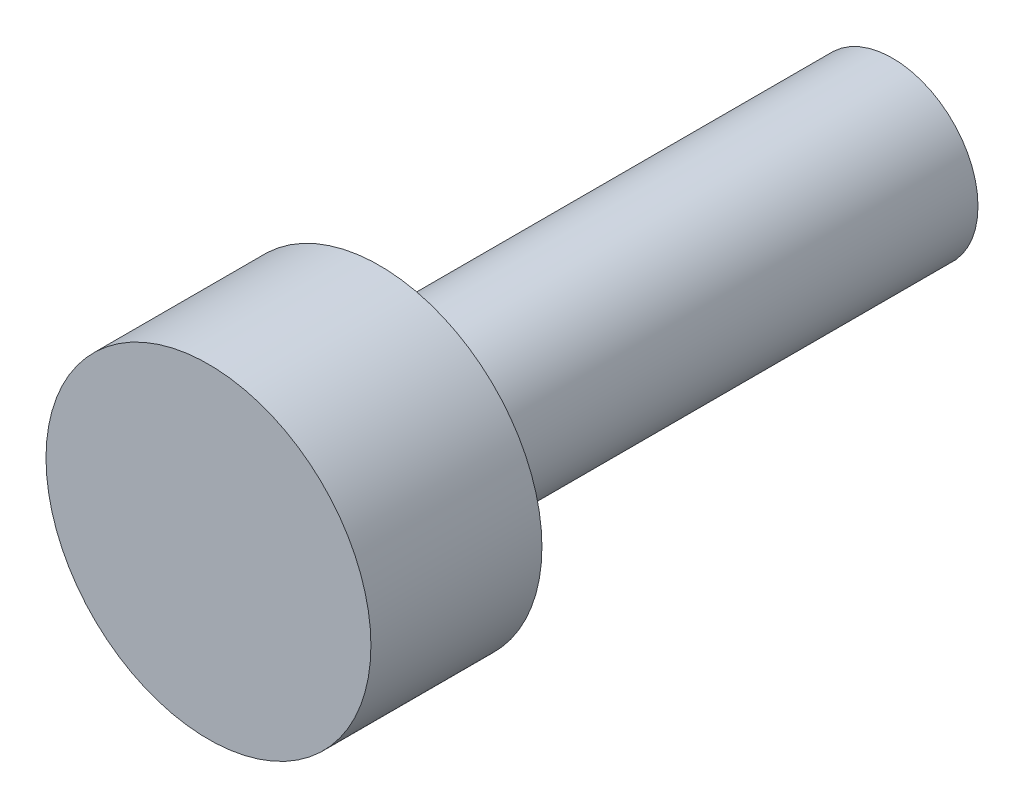
from build123d import *

# Parameters (mm, degrees)
THREAD_ENVELOPE_START = -6
SKETCH1_R             = 1
THREAD_ENVELOPE_DEPTH = 6
SKETCH2_R             = 1.9
HEAD_ENVELOPE_DEPTH   = 2


with BuildPart() as part:
    # Sketch1 → Thread_Envelope (new body)
    with BuildSketch(Plane.XY.offset(THREAD_ENVELOPE_START)):
        Circle(SKETCH1_R)
    extrude(amount=THREAD_ENVELOPE_DEPTH)

    # Sketch2 → Head_Envelope (add)
    with BuildSketch(Plane.XY):
        Circle(SKETCH2_R)
    extrude(amount=HEAD_ENVELOPE_DEPTH)


solid = part.part
